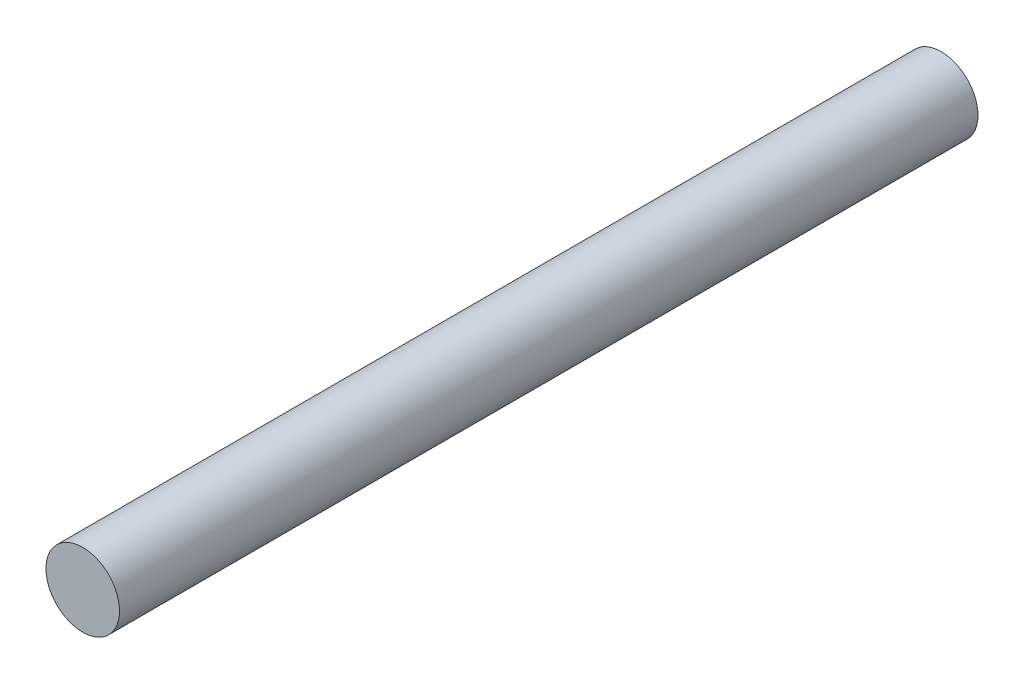
from build123d import *

# Parameters (mm, degrees)
SKETCH1_R           = 3
BOSS_EXTRUDE1_DEPTH = 35


with BuildPart() as part:
    # Sketch1 → Boss-Extrude1 (new, symmetric)
    with BuildSketch(Plane.XY):
        Circle(SKETCH1_R)
    extrude(amount=BOSS_EXTRUDE1_DEPTH, both=True)


solid = part.part
